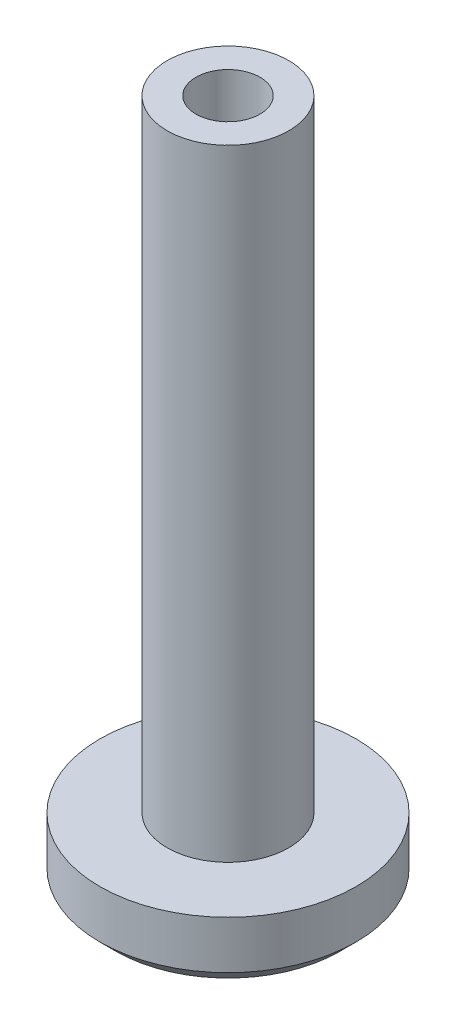
from build123d import *

# Parameters (mm, degrees)
SKETCH1_R           = 1.9
BOSS_EXTRUDE1_DEPTH = 19.4
SKETCH2_R           = 4
BOSS_EXTRUDE2_DEPTH = 2
CHAMFER1_SIZE       = 0.5
SKETCH3_R           = 1
CUT_EXTRUDE1_DEPTH  = 3


with BuildPart() as part:
    # Sketch1 → Boss-Extrude1 (new body)
    with BuildSketch(Plane(origin=(0, 0, 0), x_dir=(1, 0, 0), z_dir=(0, 1, 0))):
        with Locations(Location((0, 0, 0), (0, 0, 270))):
            Circle(SKETCH1_R)
    extrude(amount=BOSS_EXTRUDE1_DEPTH)

    # Sketch2 → Boss-Extrude2 (add)
    with BuildSketch(Plane.XZ):
        with Locations(Location((0, 0, 0), (0, 0, 270))):
            Circle(SKETCH2_R)
    extrude(amount=BOSS_EXTRUDE2_DEPTH)

    # Chamfer1
    chamfer1_edges = [part.edges().sort_by_distance(p)[0] for p in [
        (0, -2, 4),
    ]]
    chamfer(chamfer1_edges, length=CHAMFER1_SIZE)

    # Sketch3 → Cut-Extrude1 (cut)
    with BuildSketch(Plane(origin=(0, 19.4, 0), x_dir=(1, 0, 0), z_dir=(0, 1, 0))):
        with Locations(Location((0, 0, 0), (0, 0, 270))):
            Circle(SKETCH3_R)
    extrude(amount=-CUT_EXTRUDE1_DEPTH, mode=Mode.SUBTRACT)


solid = part.part
